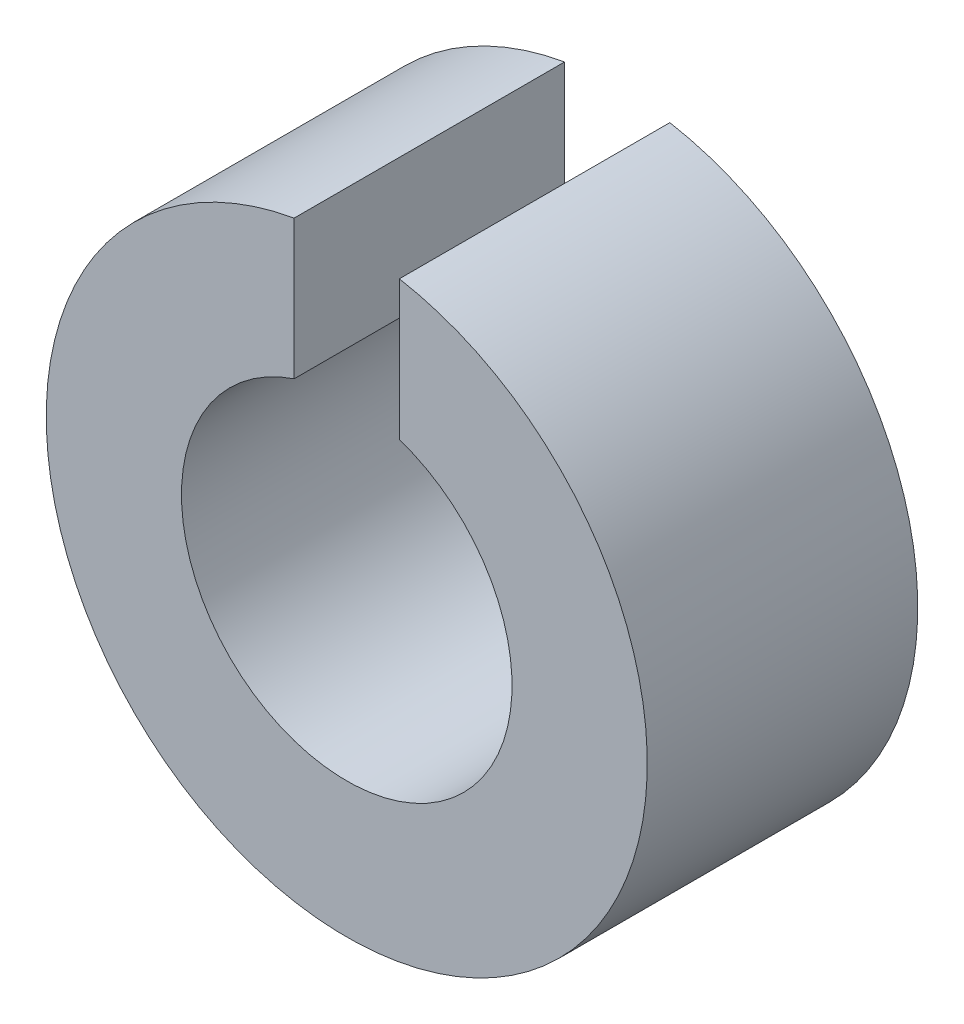
from build123d import *

# Parameters (mm, degrees)
SKETCH_1_R          = 10
SKETCH_1_R_2        = 5.5
EXTRUDE_1_DEPTH     = 9
SKETCH_2_W          = 3.5
SKETCH_2_H          = 15
CUT_EXTRUDE_1_DEPTH = 17.763054614


with BuildPart() as part:
    # Эскиз1 → Бобышка-Вытянуть1 (new body)
    with BuildSketch(Plane.XY):
        Circle(SKETCH_1_R)
        Circle(SKETCH_1_R_2, mode=Mode.SUBTRACT)
    extrude(amount=EXTRUDE_1_DEPTH)

    # Эскиз2 → Вырез-Вытянуть1 (cut, through all)
    with BuildSketch(Plane.XY.offset(9)):
        with Locations((0, 10)):
            Rectangle(SKETCH_2_W, SKETCH_2_H)
    extrude(amount=-CUT_EXTRUDE_1_DEPTH, mode=Mode.SUBTRACT)


solid = part.part
